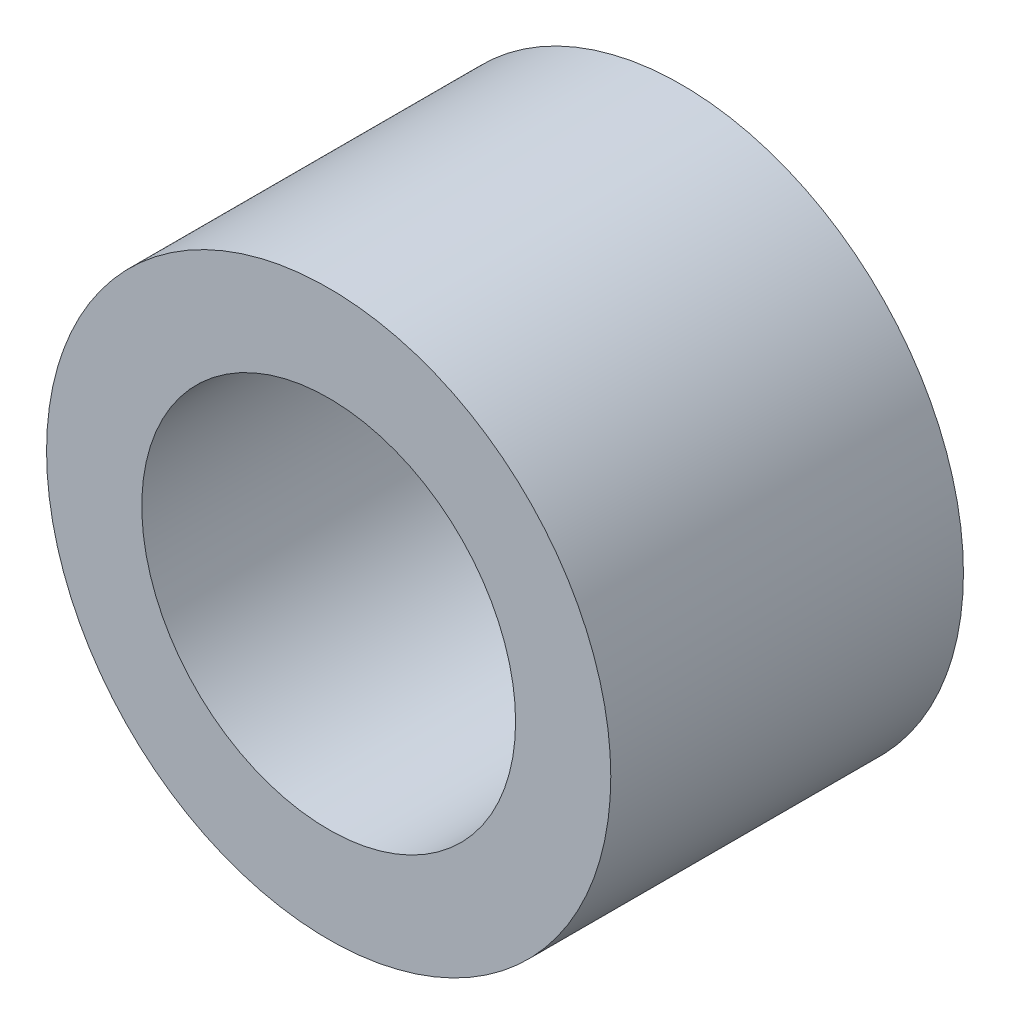
from build123d import *

# Parameters (mm, degrees)
SKETCH1_R      = 4
SKETCH1_R_2    = 2.65
EXTRUDE1_DEPTH = 2.5


with BuildPart() as part:
    # Sketch1 → Extrude1 (new, symmetric)
    with BuildSketch(Plane.XY):
        Circle(SKETCH1_R)
        Circle(SKETCH1_R_2, mode=Mode.SUBTRACT)
    extrude(amount=EXTRUDE1_DEPTH, both=True)


solid = part.part
